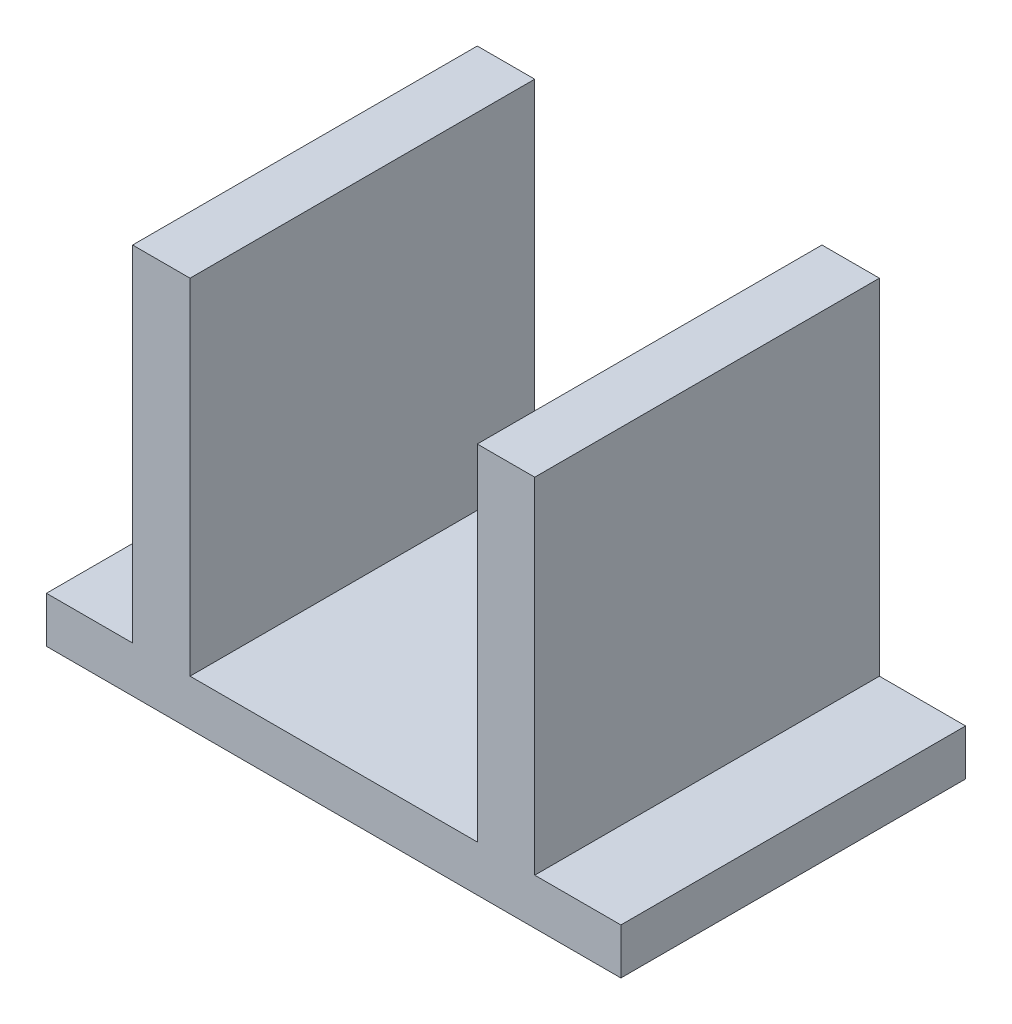
from build123d import *

# Parameters (mm, degrees)
SKETCH2_W           = 100
SKETCH2_H           = 60
BOSS_EXTRUDE1_DEPTH = 8
SKETCH3_W           = 10
SKETCH3_H           = 60
BOSS_EXTRUDE3_DEPTH = 60


with BuildPart() as part:
    # Sketch2 → Boss-Extrude1 (new body)
    with BuildSketch(Plane(origin=(0, 0, 0), x_dir=(1, 0, 0), z_dir=(0, 1, 0))):
        Rectangle(SKETCH2_W, SKETCH2_H)
    extrude(amount=BOSS_EXTRUDE1_DEPTH)

    # Sketch3 → Boss-Extrude3 (add)
    with BuildSketch(Plane(origin=(0, 8, 0), x_dir=(1, 0, 0), z_dir=(0, 1, 0))):
        with Locations((30, 0)):
            Rectangle(SKETCH3_W, SKETCH3_H)
        with Locations((-30, 0)):
            Rectangle(SKETCH3_W, SKETCH3_H)
    extrude(amount=BOSS_EXTRUDE3_DEPTH)


solid = part.part
